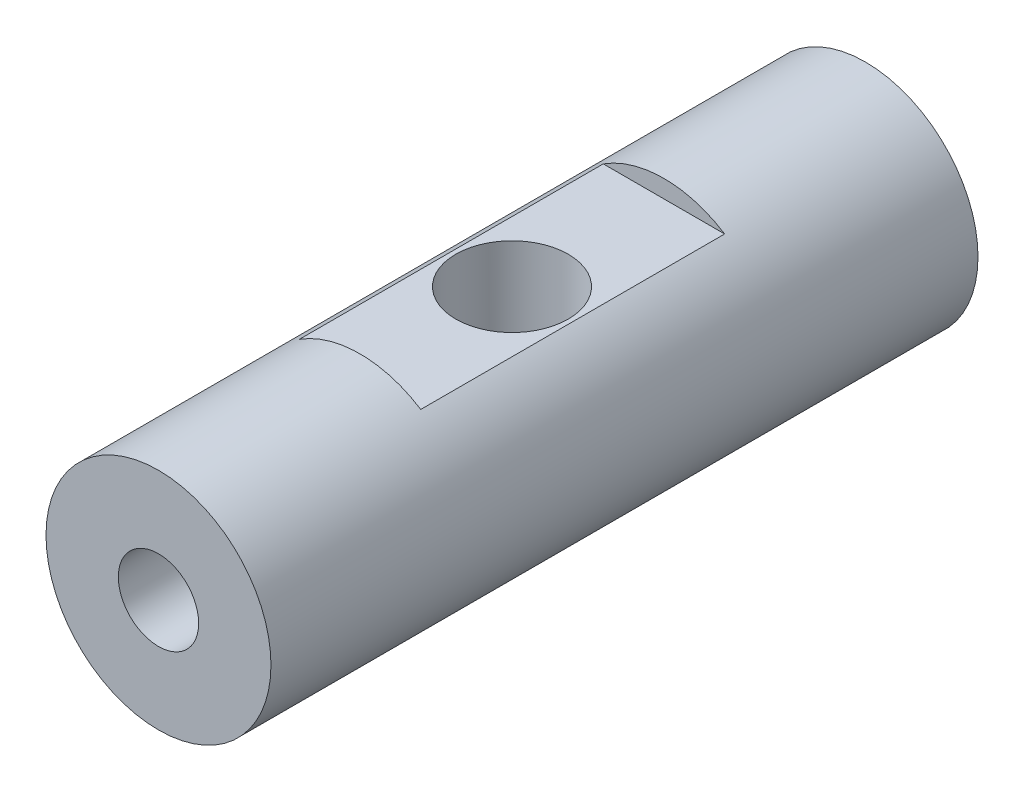
from build123d import *

# Parameters (mm, degrees)
SKETCH1_R           = 7
BOSS_EXTRUDE1_DEPTH = 44
SKETCH2_R           = 2.5
CUT_EXTRUDE1_DEPTH  = 10
CUT_EXTRUDE2_START  = -10
SKETCH3_R           = 2.5
CUT_EXTRUDE2_DEPTH  = 10
SKETCH4_R           = 3.5
CUT_EXTRUDE3_DEPTH  = 20
SKETCH5_W           = 18.912740594
SKETCH5_H           = 2.214003862
CUT_EXTRUDE5_DEPTH  = 35


with BuildPart() as part:
    # Sketch1 → Boss-Extrude1 (new body)
    with BuildSketch(Plane.XY):
        Circle(SKETCH1_R)
    extrude(amount=BOSS_EXTRUDE1_DEPTH)

    # Sketch2 → Cut-Extrude1 (cut)
    with BuildSketch(Plane.XY.offset(44)):
        Circle(SKETCH2_R)
    extrude(amount=-CUT_EXTRUDE1_DEPTH, mode=Mode.SUBTRACT)

    # Sketch3 → Cut-Extrude2 (cut)
    with BuildSketch(Plane(origin=(0, 0, 0), x_dir=(-1, 0, 0), z_dir=(0, 0, -1)).offset(CUT_EXTRUDE2_START)):
        with Locations(Location((0, 0, 0), (0, 0, 180))):
            Circle(SKETCH3_R)
    extrude(amount=CUT_EXTRUDE2_DEPTH, mode=Mode.SUBTRACT)

    # Sketch4 → Cut-Extrude3 (cut, symmetric)
    with BuildSketch(Plane(origin=(0, 0, 0), x_dir=(1, 0, 0), z_dir=(0, 1, 0))):
        with Locations(Location((0, -22, 0), (0, 0, 270))):
            Circle(SKETCH4_R)
    extrude(amount=CUT_EXTRUDE3_DEPTH, both=True, mode=Mode.SUBTRACT)

    # Sketch5 → Cut-Extrude5 (cut, symmetric)
    with BuildSketch(Plane(origin=(0, 0, 0), x_dir=(0, 0, -1), z_dir=(1, 0, 0))):
        with Locations((-22, 7)):
            Rectangle(SKETCH5_W, SKETCH5_H)
        with Locations((-22, -7)):
            Rectangle(SKETCH5_W, SKETCH5_H)
    extrude(amount=CUT_EXTRUDE5_DEPTH, both=True, mode=Mode.SUBTRACT)


solid = part.part
